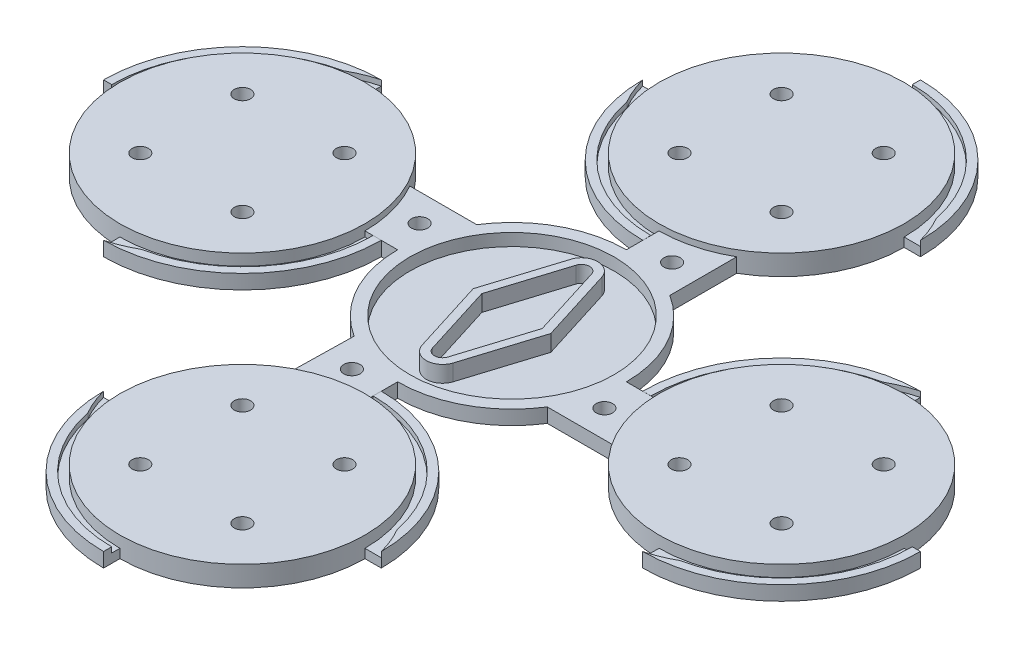
from build123d import *

# Parameters (mm, degrees)
SKETCH_1_R                           = 30
EXTRUDE_1_DEPTH                      = 11
EXTRUDE_2_DEPTH                      = 4
CUT_EXTRUDE_1_DEPTH                  = 1.32
SKETCH_8_R                           = 2
CUT_EXTRUDE_2_DEPTH                  = 50.325449821
CHAMFER_2_SIZE                       = 2
SKETCH_11_R                          = 25
EXTRUDE_4_DEPTH                      = 3.5
SKETCH_12_R                          = 25
EXTRUDE_5_DEPTH                      = 0.5
EXTRUDE_7_DEPTH                      = 4
PATTERN_CIRCULAR_1_COUNT             = 4
CHAMFER_2_OF_PATTERN_CIRCULAR_1_SIZE = 2
CUT_EXTRUDE_3_DEPTH                  = 195.10564134
CUT_EXTRUDE_3_DEPTH_BACK             = 195.10564134
EXTRUDE_8_DEPTH                      = 2
CUT_EXTRUDE_4_DEPTH                  = 194.825307945
CUT_EXTRUDE_4_DEPTH_BACK             = 194.825307945
SKETCH_17_R                          = 2


with BuildPart() as part:
    # 草图1 → 凸台-拉伸1 (new body)
    with BuildSketch(Plane(origin=(0, 0, 0), x_dir=(1, 0, 0), z_dir=(0, 1, 0))):
        with Locations(Location((0, 0, 0), (0, 0, 270))):
            Circle(SKETCH_1_R)
    extrude_1 = extrude(amount=EXTRUDE_1_DEPTH)

    # 草图3 → 凸台-拉伸2 (add)
    with BuildSketch(Plane.XZ):
        with BuildLine():
            Line((-34, 0), (-30, 0))
            ThreePointArc((-30, 0), (-21.213203436, -21.213203436), (0, -30))
            Line((0, -30), (0, -34))
            ThreePointArc((0, -34), (-24.04163056, -24.04163056), (-34, 0))
        make_face()
        with BuildLine():
            Line((0, 34), (0, 30))
            ThreePointArc((0, 30), (21.213203436, 21.213203436), (30, 0))
            Line((30, 0), (34, 0))
            ThreePointArc((34, 0), (24.04163056, 24.04163056), (0, 34))
        make_face()
    extrude_2 = extrude(amount=-EXTRUDE_2_DEPTH)

    # 草图6 → 切除-旋转8 (revolve, cut)
    with BuildSketch(Plane(origin=(0, 0, 0), x_dir=(-1, 0, 0), z_dir=(0, 0, -1)), mode=Mode.PRIVATE) as cut_revolve_8_sk:
        Polygon((-30, 2.2), (-32, 2.2), (-32, 3.52), (-34, 3.52), (-34, 4), (-30, 4), align=None)
    cut_revolve_8 = revolve(cut_revolve_8_sk.sketch.rotate(Axis((0, 0, 0), (0, 1, 0)), 270), axis=Axis((0, 0, 0), (0, 1, 0)), mode=Mode.SUBTRACT)

    # 草图7 → 切除-拉伸1 (cut)
    with BuildSketch(Plane(origin=(0, 3.52, 0), x_dir=(1, 0, 0), z_dir=(0, 1, 0))):
        with BuildLine():
            Line((6.522408084, -31.328233158), (-2.191886095, -31.444458777))
            Line((-2.191886095, -31.444458777), (0, -34))
            ThreePointArc((0, -34), (3.348762467, -32.877867185), (6.522408084, -31.328233158))
        make_face()
        with BuildLine():
            Line((-6.522408084, 31.328233158), (2.581044054, 31.031256101))
            Line((2.581044054, 31.031256101), (0, 34))
            ThreePointArc((0, 34), (-3.348762467, 32.877867185), (-6.522408084, 31.328233158))
        make_face()
    cut_extrude_1 = extrude(amount=-CUT_EXTRUDE_1_DEPTH, mode=Mode.SUBTRACT)

    # 草图8 → 切除-拉伸2 (cut, through all)
    with BuildSketch(Plane(origin=(0, 11, 0), x_dir=(1, 0, 0), z_dir=(0, 1, 0))):
        with BuildLine():
            ThreePointArc((14.5, 12.5), (13.914213562, 13.914213562), (12.5, 14.5))
            Line((12.5, 14.5), (12.5, 10.5))
            ThreePointArc((12.5, 10.5), (13.914213562, 11.085786438), (14.5, 12.5))
        make_face()
        with BuildLine():
            Line((12.5, 10.5), (12.5, 14.5))
            ThreePointArc((12.5, 14.5), (10.5, 12.5), (12.5, 10.5))
        make_face()
        with BuildLine():
            ThreePointArc((-12.5, -10.5), (-13.914213562, -11.085786438), (-14.5, -12.5))
            Line((-14.5, -12.5), (-12.5, -12.5))
            Line((-12.5, -12.5), (-12.5, -10.5))
        make_face()
        with BuildLine():
            Line((-12.5, -12.5), (-14.5, -12.5))
            ThreePointArc((-14.5, -12.5), (-13.914213562, -13.914213562), (-12.5, -14.5))
            Line((-12.5, -14.5), (-12.5, -12.5))
        make_face()
        with BuildLine():
            ThreePointArc((-10.5, -12.5), (-11.085786438, -11.085786438), (-12.5, -10.5))
            Line((-12.5, -10.5), (-12.5, -12.5))
            Line((-12.5, -12.5), (-10.5, -12.5))
        make_face()
        with BuildLine():
            Line((-10.5, -12.5), (-12.5, -12.5))
            Line((-12.5, -12.5), (-12.5, -14.5))
            ThreePointArc((-12.5, -14.5), (-11.085786438, -13.914213562), (-10.5, -12.5))
        make_face()
        with Locations(Location((12.5, -12.5, 0), (0, 0, 270))):
            Circle(SKETCH_8_R)
        with Locations(Location((-12.5, 12.5, 0), (0, 0, 270))):
            Circle(SKETCH_8_R)
    cut_extrude_2 = extrude(amount=-CUT_EXTRUDE_2_DEPTH, mode=Mode.SUBTRACT)

    # 倒角2
    chamfer_2_edges = [part.edges().sort_by_distance(p)[0] for p in [
        (-12.5, 11, -14.5),
        (12.5, 11, 10.5),
        (-12.5, 11, 10.5),
        (12.5, 11, -14.5),
    ]]
    chamfer(chamfer_2_edges, length=CHAMFER_2_SIZE)

    # 草图11 → 凸台-拉伸4 (add)
    with BuildSketch(Plane(origin=(0, 0, 0), x_dir=(1, 0, 0), z_dir=(0, 1, 0))):
        with BuildLine():
            Line((30, 0), (38, 0))
            ThreePointArc((38, 0), (41.464311707, -13.490737563), (51, -23.643180835))
            Line((51, -23.643180835), (51, -40.019237886))
            ThreePointArc((51, -40.019237886), (58.235428647, -37.022225211), (66, -36))
            Line((66, -36), (66, -28))
            ThreePointArc((66, -28), (79.490737563, -24.535688293), (89.643180835, -15))
            Line((89.643180835, -15), (106.019237886, -15))
            ThreePointArc((106.019237886, -15), (103.022225211, -7.764571353), (102, 0))
            Line((102, 0), (94, 0))
            ThreePointArc((94, 0), (90.535688293, 13.490737563), (81, 23.643180835))
            Line((81, 23.643180835), (81, 40.019237886))
            ThreePointArc((81, 40.019237886), (73.764571353, 37.022225211), (66, 36))
            Line((66, 36), (66, 28))
            ThreePointArc((66, 28), (52.509262437, 24.535688293), (42.356819165, 15))
            Line((42.356819165, 15), (25.980762114, 15))
            ThreePointArc((25.980762114, 15), (28.977774789, 7.764571353), (30, 0))
        make_face()
        with Locations(Location((66, 0, 0), (0, 0, 270))):
            Circle(SKETCH_11_R, mode=Mode.SUBTRACT)
    extrude(amount=EXTRUDE_4_DEPTH)

    # 草图12 → 凸台-拉伸5 (add)
    with BuildSketch(Plane.XZ):
        with Locations(Location((66, 0, 0), (0, 0, 270))):
            Circle(SKETCH_12_R)
    extrude(amount=-EXTRUDE_5_DEPTH)

    # 草图13 → 凸台-拉伸7 (add)
    with BuildSketch(Plane(origin=(0, 0.5, 0), x_dir=(1, 0, 0), z_dir=(0, 1, 0))):
        with BuildLine():
            Line((62.103972011, 17.813244072), (56.5, 0))
            Line((56.5, 0), (62.202222754, -18.190499049))
            ThreePointArc((62.202222754, -18.190499049), (66, -20.98), (69.797777246, -18.190499049))
            Line((69.797777246, -18.190499049), (75.5, 0))
            Line((75.5, 0), (69.797777247, 18.190499048))
            ThreePointArc((69.797777247, 18.190499048), (66.198983725, 20.975022701), (62.340099833, 18.563819291))
            Line((62.340099833, 18.563819291), (62.103972011, 17.813244072))
        make_face()
        with BuildLine():
            Line((64.110529809, -17.591863495), (58.6, 0))
            Line((58.6, 0), (64.110529808, 17.591863494))
            ThreePointArc((64.110529808, 17.591863494), (66, 18.979999999), (67.889470191, 17.591863494))
            Line((67.889470191, 17.591863494), (73.4, 0))
            Line((73.4, 0), (67.889470191, -17.591863495))
            ThreePointArc((67.889470191, -17.591863495), (66, -18.98), (64.110529809, -17.591863495))
        make_face(mode=Mode.SUBTRACT)
    extrude(amount=EXTRUDE_7_DEPTH)

    # 阵列(圆周)1: 凸台-拉伸1, 凸台-拉伸2, 切除-旋转8, 切除-拉伸1, 切除-拉伸2 ×4 about axis
    pattern_circular_1_axis = Axis((66, 0, 0), (0, 1, 0))
    add([extrude_1.rotate(pattern_circular_1_axis, i * 360 / PATTERN_CIRCULAR_1_COUNT) for i in range(1, PATTERN_CIRCULAR_1_COUNT)])
    add([extrude_2.rotate(pattern_circular_1_axis, i * 360 / PATTERN_CIRCULAR_1_COUNT) for i in range(1, PATTERN_CIRCULAR_1_COUNT)])
    add([cut_revolve_8.rotate(pattern_circular_1_axis, i * 360 / PATTERN_CIRCULAR_1_COUNT) for i in range(1, PATTERN_CIRCULAR_1_COUNT)], mode=Mode.SUBTRACT)
    add([cut_extrude_1.rotate(pattern_circular_1_axis, i * 360 / PATTERN_CIRCULAR_1_COUNT) for i in range(1, PATTERN_CIRCULAR_1_COUNT)], mode=Mode.SUBTRACT)
    add([cut_extrude_2.rotate(pattern_circular_1_axis, i * 360 / PATTERN_CIRCULAR_1_COUNT) for i in range(1, PATTERN_CIRCULAR_1_COUNT)], mode=Mode.SUBTRACT)

    # 倒角2 of 阵列(圆周)1
    chamfer_2_of_pattern_circular_1_edges = [part.edges().sort_by_distance(p)[0] for p in [
        (51.5, 11, 78.5),
        (76.5, 11, 53.5),
        (76.5, 11, 78.5),
        (51.5, 11, 53.5),
        (144.5, 11, 14.5),
        (119.5, 11, -10.5),
        (144.5, 11, -10.5),
        (119.5, 11, 14.5),
        (80.5, 11, -78.5),
        (55.5, 11, -53.5),
        (55.5, 11, -78.5),
        (80.5, 11, -53.5),
    ]]
    chamfer(chamfer_2_of_pattern_circular_1_edges, length=CHAMFER_2_OF_PATTERN_CIRCULAR_1_SIZE)

    # 草图14 → 切除-拉伸3 (cut, two sides: drawn at the far end of the back side and taken through both)
    with BuildSketch(Plane.XY.offset(-CUT_EXTRUDE_3_DEPTH_BACK)):
        Polygon((-30, 11), (-30, 5), (176.975680525, 5), (176.975680525, 23.53934312), (-30, 23.53934312), align=None)
    extrude(amount=CUT_EXTRUDE_3_DEPTH + CUT_EXTRUDE_3_DEPTH_BACK, mode=Mode.SUBTRACT)

    # 草图15 → 凸台-拉伸8 (add)
    with BuildSketch(Plane(origin=(0, 3.5, 0), x_dir=(1, 0, 0), z_dir=(0, 1, 0))):
        Polygon((66, 34), (66, 37.303115958), (66, 66), (76.007187768, 45.066561644), (81, 42.202815596), (81, 37.73341195), (81, 32.535817428), align=None)
        Polygon((103.73341195, -15), (111.34880517, -15), (111.34880517, 0), (100, 0), (100, -15), align=None)
        Polygon((66, -28), (66, -39.176319492), (50.642422136, -42.217247803), (51, -23.643180835), align=None)
    extrude(amount=-EXTRUDE_8_DEPTH)

    # 草图17 → 切除-拉伸4 (cut, two sides: drawn at the far end of the back side and taken through both)
    with BuildSketch(Plane(origin=(0, 3.5, 0), x_dir=(1, 0, 0), z_dir=(0, 1, 0)).offset(-CUT_EXTRUDE_4_DEPTH_BACK)):
        with Locations(Location((35.090373559, 8.282209443, 0), (0, 0, 270))):
            Circle(SKETCH_17_R)
        with Locations(Location((74.282209443, 30.909626441, 0), (0, 0, 270))):
            Circle(SKETCH_17_R)
        with Locations(Location((96.909626441, -8.282209443, 0), (0, 0, 270))):
            Circle(SKETCH_17_R)
        with Locations(Location((57.717790557, -30.909626441, 0), (0, 0, 270))):
            Circle(SKETCH_17_R)
    extrude(amount=CUT_EXTRUDE_4_DEPTH + CUT_EXTRUDE_4_DEPTH_BACK, mode=Mode.SUBTRACT)


solid = part.part
